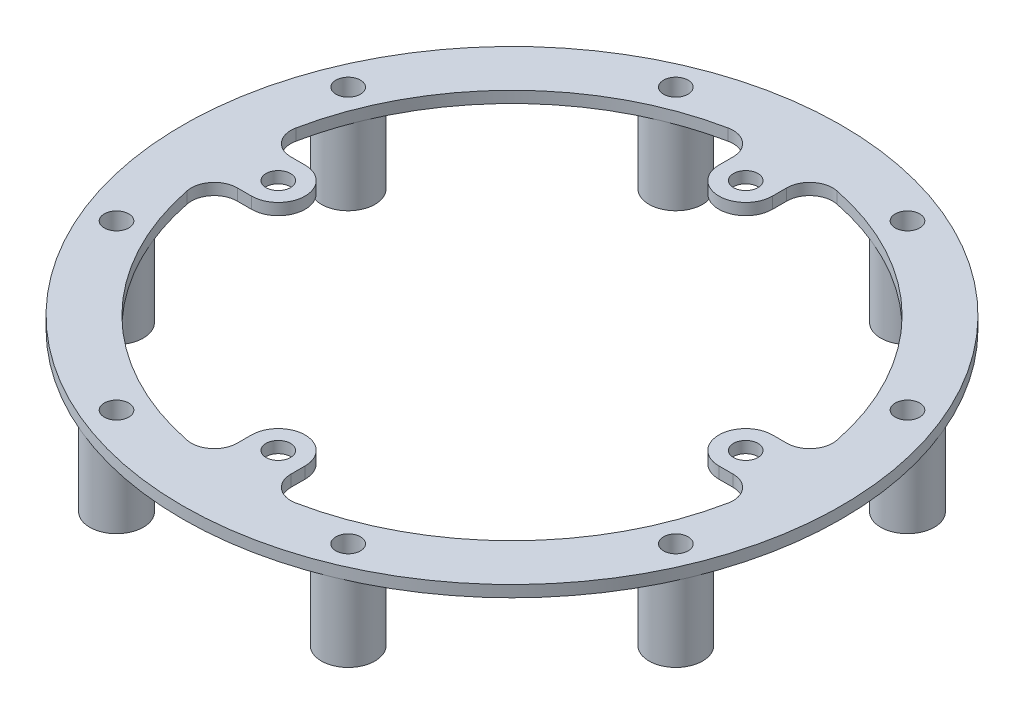
from build123d import *
from build123d.topology import SkipClean

# Parameters (mm, degrees)
ESBO_O1_R                = 43
ESBO_O1_R_2              = 1.6
RESSALTO_EXTRUS_O1_DEPTH = 0.75
FILETE2_R                = 3
RESSALTO_EXTRUS_O2_START = 10
ESBO_O2_R                = 3.5
ESBO_O2_R_2              = 1.6
RESSALTO_EXTRUS_O2_DEPTH = 10


with BuildPart() as part:
    # Esboço1 → Ressalto-extrusão1 (new, symmetric)
    with BuildSketch(Plane(origin=(0, 0, 0), x_dir=(1, 0, 0), z_dir=(0, 1, 0))):
        with Locations(Location((0, 0, 0), (0, 0, 270))):
            Circle(ESBO_O1_R)
        with Locations(Location((-36.493241534, 15.115995578, 0), (0, 0, 270))):
            Circle(ESBO_O1_R_2, mode=Mode.SUBTRACT)
        with Locations(Location((-15.115995578, 36.493241534, 0), (0, 0, 270))):
            Circle(ESBO_O1_R_2, mode=Mode.SUBTRACT)
        with Locations(Location((15.115995578, 36.493241534, 0), (0, 0, 270))):
            Circle(ESBO_O1_R_2, mode=Mode.SUBTRACT)
        with Locations(Location((36.493241534, 15.115995578, 0), (0, 0, 270))):
            Circle(ESBO_O1_R_2, mode=Mode.SUBTRACT)
        with Locations(Location((36.493241534, -15.115995578, 0), (0, 0, 270))):
            Circle(ESBO_O1_R_2, mode=Mode.SUBTRACT)
        with Locations(Location((15.115995578, -36.493241534, 0), (0, 0, 270))):
            Circle(ESBO_O1_R_2, mode=Mode.SUBTRACT)
        with Locations(Location((-15.115995578, -36.493241534, 0), (0, 0, 270))):
            Circle(ESBO_O1_R_2, mode=Mode.SUBTRACT)
        with Locations(Location((-36.493241534, -15.115995578, 0), (0, 0, 270))):
            Circle(ESBO_O1_R_2, mode=Mode.SUBTRACT)
        with Locations(Location((0, 30.497713542, 0), (0, 0, 270))):
            Circle(ESBO_O1_R_2, mode=Mode.SUBTRACT)
        with Locations(Location((30.497713542, 0, 0), (0, 0, 270))):
            Circle(ESBO_O1_R_2, mode=Mode.SUBTRACT)
        with Locations(Location((0, -30.497713542, 0), (0, 0, 270))):
            Circle(ESBO_O1_R_2, mode=Mode.SUBTRACT)
        with Locations(Location((-30.497713542, 0, 0), (0, 0, 270))):
            Circle(ESBO_O1_R_2, mode=Mode.SUBTRACT)
        with BuildLine():
            Line((-3.5, 30.497713542), (-3.5, 35.829457155))
            ThreePointArc((-3.5, 35.829457155), (-25.455844123, 25.455844123), (-35.829457155, 3.5))
            Line((-35.829457155, 3.5), (-30.497713542, 3.5))
            ThreePointArc((-30.497713542, 3.5), (-26.997713542, 0), (-30.497713542, -3.5))
            Line((-30.497713542, -3.5), (-35.829457155, -3.5))
            ThreePointArc((-35.829457155, -3.5), (-25.455844123, -25.455844123), (-3.5, -35.829457155))
            Line((-3.5, -35.829457155), (-3.5, -30.497713542))
            ThreePointArc((-3.5, -30.497713542), (0, -26.997713542), (3.5, -30.497713542))
            Line((3.5, -30.497713542), (3.5, -35.829457155))
            ThreePointArc((3.5, -35.829457155), (25.455844123, -25.455844123), (35.829457155, -3.5))
            Line((35.829457155, -3.5), (30.497713542, -3.5))
            ThreePointArc((30.497713542, -3.5), (26.997713542, 0), (30.497713542, 3.5))
            Line((30.497713542, 3.5), (35.829457155, 3.5))
            ThreePointArc((35.829457155, 3.5), (25.455844123, 25.455844123), (3.5, 35.829457155))
            Line((3.5, 35.829457155), (3.5, 30.497713542))
            ThreePointArc((3.5, 30.497713542), (0, 26.997713542), (-3.5, 30.497713542))
        make_face(mode=Mode.SUBTRACT)
    extrude(amount=RESSALTO_EXTRUS_O1_DEPTH, both=True)

    # Filete2
    filete2_edges = [part.edges().sort_by_distance(p)[0] for p in [
        (35.829457155, 0, -3.5),
        (3.5, 0, -35.829457155),
        (-3.5, 0, -35.829457155),
        (-35.829457155, 0, -3.5),
        (-35.829457155, 0, 3.5),
        (-3.5, 0, 35.829457155),
        (3.5, 0, 35.829457155),
        (35.829457155, 0, 3.5),
    ]]
    fillet(filete2_edges, radius=FILETE2_R)

    # Esboço2 → Ressalto-extrusão2 (add)
    # profile 1 of 8: a face of its own
    with SkipClean():  # the faces are left unmerged after this step: merging them gives an invalid solid
        with BuildSketch(Plane.XZ.offset(0.75).offset(RESSALTO_EXTRUS_O2_START)):
            with Locations(Location((-15.115995578, 36.493241534, 0), (0, 0, 112.5))):
                Circle(ESBO_O2_R)
            with Locations(Location((-15.115995578, 36.493241534, 0), (0, 0, 270))):
                Circle(ESBO_O2_R_2, mode=Mode.SUBTRACT)
        # profile 2 of 8: a face of its own
        with BuildSketch(Plane.XZ.offset(0.75).offset(RESSALTO_EXTRUS_O2_START)):
            with Locations(Location((15.115995578, 36.493241534, 0), (0, 0, 67.5))):
                Circle(ESBO_O2_R)
            with Locations(Location((15.115995578, 36.493241534, 0), (0, 0, 270))):
                Circle(ESBO_O2_R_2, mode=Mode.SUBTRACT)
        # profile 3 of 8: a face of its own
        with BuildSketch(Plane.XZ.offset(0.75).offset(RESSALTO_EXTRUS_O2_START)):
            with Locations(Location((36.493241534, 15.115995578, 0), (0, 0, 22.5))):
                Circle(ESBO_O2_R)
            with Locations(Location((36.493241534, 15.115995578, 0), (0, 0, 270))):
                Circle(ESBO_O2_R_2, mode=Mode.SUBTRACT)
        # profile 4 of 8: a face of its own
        with BuildSketch(Plane.XZ.offset(0.75).offset(RESSALTO_EXTRUS_O2_START)):
            with Locations(Location((36.493241534, -15.115995578, 0), (0, 0, 157.5))):
                Circle(ESBO_O2_R)
            with Locations(Location((36.493241534, -15.115995578, 0), (0, 0, 270))):
                Circle(ESBO_O2_R_2, mode=Mode.SUBTRACT)
        # profile 5 of 8: a face of its own
        with BuildSketch(Plane.XZ.offset(0.75).offset(RESSALTO_EXTRUS_O2_START)):
            with Locations(Location((15.115995578, -36.493241534, 0), (0, 0, 112.5))):
                Circle(ESBO_O2_R)
            with Locations(Location((15.115995578, -36.493241534, 0), (0, 0, 270))):
                Circle(ESBO_O2_R_2, mode=Mode.SUBTRACT)
        # profile 6 of 8: a face of its own
        with BuildSketch(Plane.XZ.offset(0.75).offset(RESSALTO_EXTRUS_O2_START)):
            with Locations(Location((-15.115995578, -36.493241534, 0), (0, 0, 67.5))):
                Circle(ESBO_O2_R)
            with Locations(Location((-15.115995578, -36.493241534, 0), (0, 0, 270))):
                Circle(ESBO_O2_R_2, mode=Mode.SUBTRACT)
        # profile 7 of 8: a face of its own
        with BuildSketch(Plane.XZ.offset(0.75).offset(RESSALTO_EXTRUS_O2_START)):
            with Locations(Location((-36.493241534, -15.115995578, 0), (0, 0, 22.5))):
                Circle(ESBO_O2_R)
            with Locations(Location((-36.493241534, -15.115995578, 0), (0, 0, 270))):
                Circle(ESBO_O2_R_2, mode=Mode.SUBTRACT)
        # profile 8 of 8: a face of its own
        with BuildSketch(Plane.XZ.offset(0.75).offset(RESSALTO_EXTRUS_O2_START)):
            with Locations(Location((-36.493241534, 15.115995578, 0), (0, 0, 157.5))):
                Circle(ESBO_O2_R)
            with Locations(Location((-36.493241534, 15.115995578, 0), (0, 0, 270))):
                Circle(ESBO_O2_R_2, mode=Mode.SUBTRACT)
        extrude(amount=-RESSALTO_EXTRUS_O2_DEPTH)


solid = part.part
